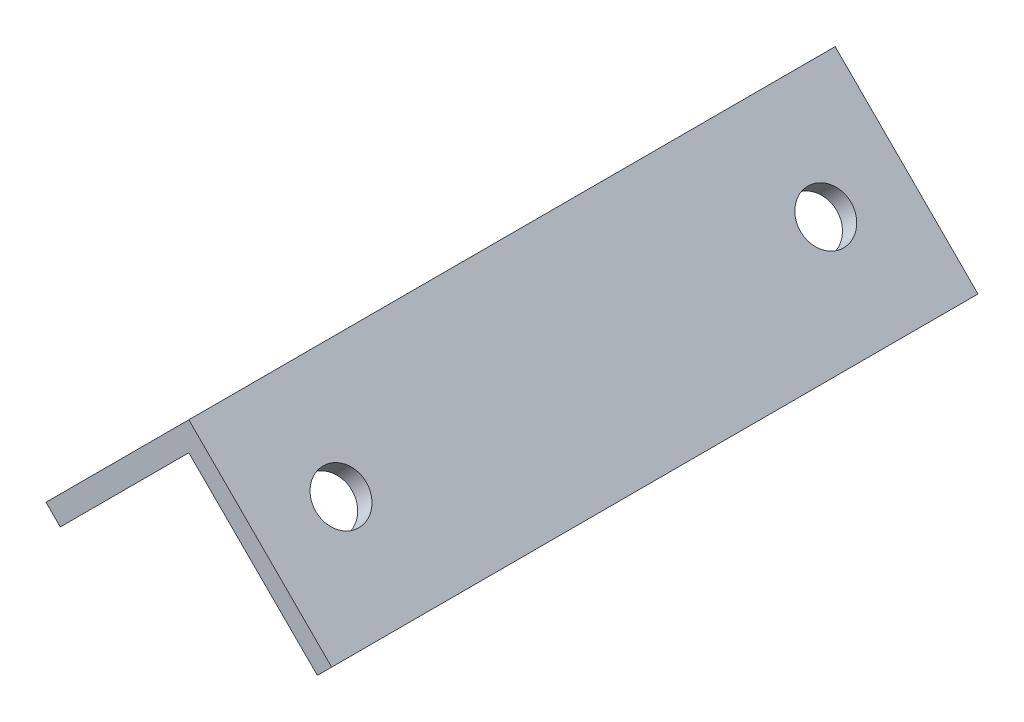
from build123d import *

# Parameters (mm, degrees)
BOSS_EXTRUDE1_DEPTH     = 101.6
SKETCH4_R               = 3.9751
CUT_EXTRUDE3_DEPTH      = 114.32570869
ESQUISSE1_R             = 3.9751
ENL_V_MAT_EXTRU_1_DEPTH = 107.941428186


with BuildPart() as part:
    # Sketch1 → Boss-Extrude1 (new body)
    with BuildSketch(Plane.XY):
        Polygon((0, 0), (22.450640303, 22.450640303), (44.901280605, 0), (42.656216575, -2.24506403), (22.450640303, 17.960512242), (2.24506403, -2.24506403), align=None)
    extrude(amount=BOSS_EXTRUDE1_DEPTH)

    # Sketch4 → Cut-Extrude3 (cut, through all)
    with BuildSketch(Plane(origin=(0, 0, 0), x_dir=(0, 0, 1), z_dir=(-0.7071067811865476, 0.7071067811865475, 0))):
        with Locations(Location((31.75, 15.875, 0), (0, 0, 270))):
            Circle(SKETCH4_R)
        with Locations(Location((69.85, 15.875, 0), (0, 0, 270))):
            Circle(SKETCH4_R)
    extrude(amount=-CUT_EXTRUDE3_DEPTH, mode=Mode.SUBTRACT)

    # Esquisse1 → Enlèv. mat.-Extru.1 (cut, through all)
    with BuildSketch(Plane(origin=(22.450640303, 22.450640303, 0), x_dir=(-0.7071067811865476, 0.7071067811865475, 0), z_dir=(0.7071067811865475, 0.7071067811865476, 0))):
        with Locations((-15.875, 12.7)):
            Circle(ESQUISSE1_R)
    enl_v_mat_extru_1 = extrude(amount=-ENL_V_MAT_EXTRU_1_DEPTH, mode=Mode.SUBTRACT)

    # Symétrie1: Enlèv. mat.-Extru.1 across plane
    add(enl_v_mat_extru_1.mirror(Plane.XY.offset(50.8)), mode=Mode.SUBTRACT)


solid = part.part
